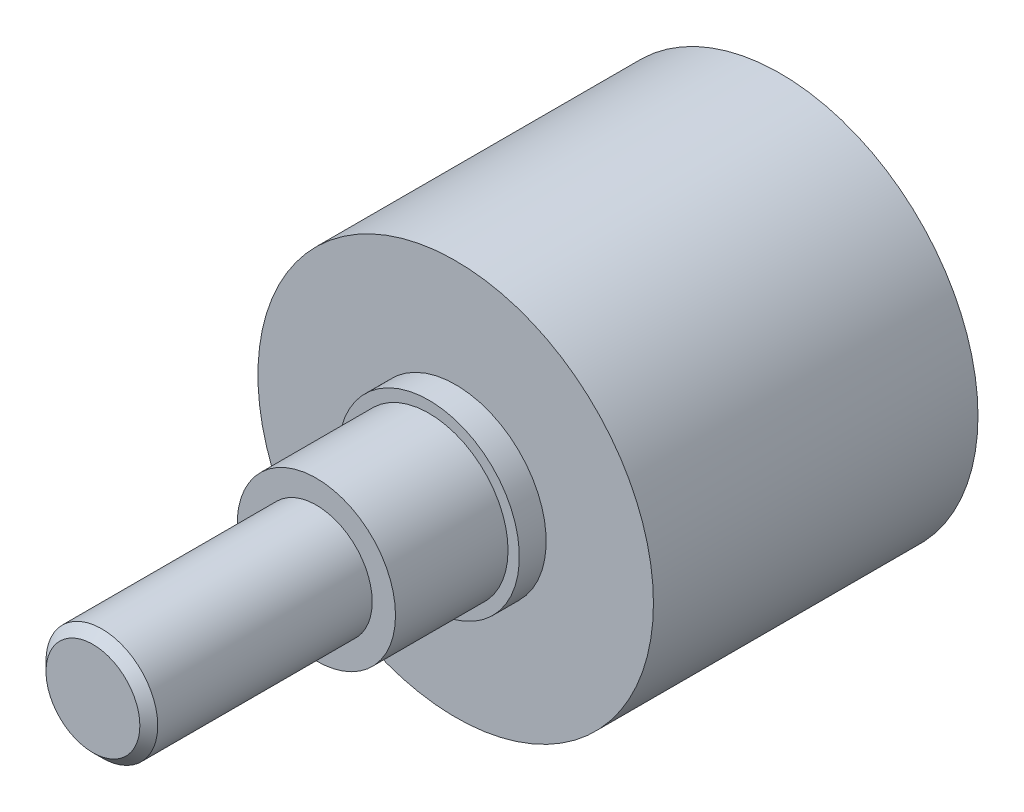
from build123d import *

# Parameters (mm, degrees)
SKETCH1_R       = 11.2395
BODY_DEPTH      = 18.446
SKETCH2_R       = 5.1435
LIP_DEPTH       = 1.524
SKETCH3_R       = 4.5
THREADING_DEPTH = 6.396
SKETCH4_R       = 3.175
SHAFT_DEPTH     = 20.617
CHAMFER1_SIZE   = 0.508


with BuildPart() as part:
    # Sketch1 → Body (new body)
    with BuildSketch(Plane.XY):
        Circle(SKETCH1_R)
    extrude(amount=BODY_DEPTH)

    # Sketch2 → Lip (add)
    with BuildSketch(Plane.XY.offset(18.446)):
        with Locations(Location((0, 0, 0), (0, 0, 180))):
            Circle(SKETCH2_R)
    extrude(amount=LIP_DEPTH)

    # Sketch3 → Threading (add)
    with BuildSketch(Plane.XY.offset(19.97)):
        Circle(SKETCH3_R)
    extrude(amount=THREADING_DEPTH)

    # Sketch4 → Shaft (add)
    with BuildSketch(Plane.XY.offset(18.446)):
        Circle(SKETCH4_R)
    extrude(amount=SHAFT_DEPTH)

    # Chamfer1
    chamfer1_edges = [part.edges().sort_by_distance(p)[0] for p in [
        (-3.175, 0, 39.063),
    ]]
    chamfer(chamfer1_edges, length=CHAMFER1_SIZE)


solid = part.part
